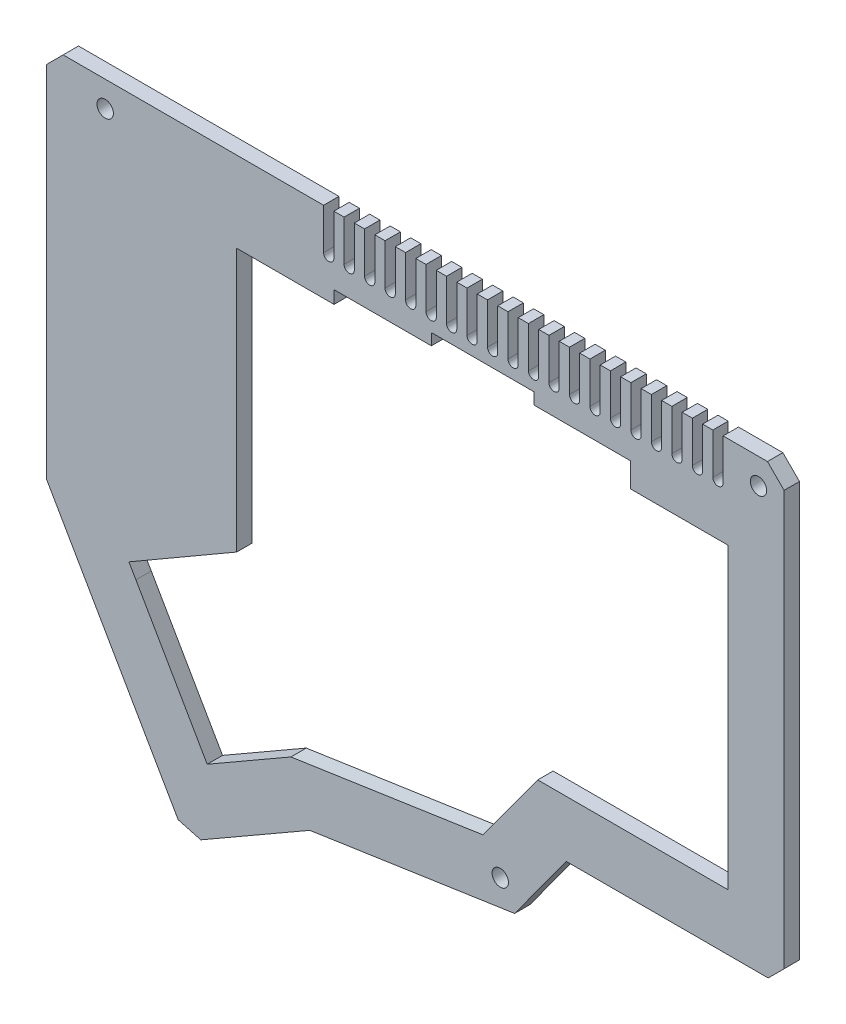
from build123d import *

# Parameters (mm, degrees)
ESQUISSE1_R             = 1.6
BOSS_EXTRU_1_DEPTH      = 3
ENL_V_MAT_EXTRU_1_DEPTH = 10


with BuildPart() as part:
    # Esquisse1 → Boss.-Extru.1 (new body)
    with BuildSketch(Plane.XY):
        Polygon((-13.474992457, 0.072428093), (-16.723236211, 3.320852512), (-154.236345188, 3.320852512), (-157.478985875, 0.078211825), (-157.478985875, -70.04068474), (-131.779420125, -114.771472067), (-127.355917516, -115.9649154), (-106.081983802, -103.720194839), (-66.092540926, -97.775797545), (-55.98795635, -83.933633781), (-16.581747648, -83.933633781), (-13.474992457, -80.826878591), align=None)
        Polygon((-126.111124489, -102.556497988), (-140.02282508, -78.342807898), (-141.407217303, -75.981121034), (-120.346626934, -63.796065222), (-120.346308835, -12.429484403), (-101.345774335, -12.429484403), (-101.345774335, -9.929307079), (-82.344426674, -9.929307079), (-82.344426674, -7.679926158), (-62.343149943, -7.681038584), (-62.343149943, -9.929307079), (-43.477687779, -9.929307079), (-43.477687779, -14.679643994), (-24.474992457, -14.679643994), (-24.474992457, -72.933633781), (-61.577157206, -72.933633781), (-72.263087593, -87.572177036), (-109.761976756, -93.1463556), align=None, mode=Mode.SUBTRACT)
        with Locations((-68.897334865, -93.137788223)):
            Circle(ESQUISSE1_R, mode=Mode.SUBTRACT)
        with Locations((-146.02282508, -1.677868186)):
            Circle(ESQUISSE1_R, mode=Mode.SUBTRACT)
        with Locations((-18.474992457, -1.68453516)):
            Circle(ESQUISSE1_R, mode=Mode.SUBTRACT)
    extrude(amount=BOSS_EXTRU_1_DEPTH)

    # Esquisse2 → Enlèv. mat.-Extru.1 (cut)
    with BuildSketch(Plane.XY.offset(3)):
        with BuildLine():
            Line((-25.386559375, 6.054162745), (-25.386559375, -4.679147488))
            ThreePointArc((-25.386559375, -4.679147488), (-26.386559375, -5.679147488), (-27.386559375, -4.679147488))
            Line((-27.386559375, -4.679147488), (-27.386559375, 6.054162745))
            ThreePointArc((-27.386559375, 6.054162745), (-26.386559375, 7.054162745), (-25.386559375, 6.054162745))
        make_face()
        with BuildLine():
            Line((-29.386559375, 6.054162745), (-29.386559375, -4.679147488))
            ThreePointArc((-29.386559375, -4.679147488), (-30.386559375, -5.679147488), (-31.386559375, -4.679147488))
            Line((-31.386559375, -4.679147488), (-31.386559375, 6.054162745))
            ThreePointArc((-31.386559375, 6.054162745), (-30.386559375, 7.054162745), (-29.386559375, 6.054162745))
        make_face()
        with BuildLine():
            Line((-33.386559375, 6.054162745), (-33.386559375, -4.679147488))
            ThreePointArc((-33.386559375, -4.679147488), (-34.386559375, -5.679147488), (-35.386559375, -4.679147488))
            Line((-35.386559375, -4.679147488), (-35.386559375, 6.054162745))
            ThreePointArc((-35.386559375, 6.054162745), (-34.386559375, 7.054162745), (-33.386559375, 6.054162745))
        make_face()
        with BuildLine():
            Line((-37.386559375, 6.054162745), (-37.386559375, -4.679147488))
            ThreePointArc((-37.386559375, -4.679147488), (-38.386559375, -5.679147488), (-39.386559375, -4.679147488))
            Line((-39.386559375, -4.679147488), (-39.386559375, 6.054162745))
            ThreePointArc((-39.386559375, 6.054162745), (-38.386559375, 7.054162745), (-37.386559375, 6.054162745))
        make_face()
        with BuildLine():
            Line((-41.386559375, 6.054162745), (-41.386559375, -4.679147488))
            ThreePointArc((-41.386559375, -4.679147488), (-42.386559375, -5.679147488), (-43.386559375, -4.679147488))
            Line((-43.386559375, -4.679147488), (-43.386559375, 6.054162745))
            ThreePointArc((-43.386559375, 6.054162745), (-42.386559375, 7.054162745), (-41.386559375, 6.054162745))
        make_face()
        with BuildLine():
            Line((-45.386559375, 6.054162745), (-45.386559375, -4.679147488))
            ThreePointArc((-45.386559375, -4.679147488), (-46.386559375, -5.679147488), (-47.386559375, -4.679147488))
            Line((-47.386559375, -4.679147488), (-47.386559375, 6.054162745))
            ThreePointArc((-47.386559375, 6.054162745), (-46.386559375, 7.054162745), (-45.386559375, 6.054162745))
        make_face()
        with BuildLine():
            Line((-49.386559375, 6.054162745), (-49.386559375, -4.679147488))
            ThreePointArc((-49.386559375, -4.679147488), (-50.386559375, -5.679147488), (-51.386559375, -4.679147488))
            Line((-51.386559375, -4.679147488), (-51.386559375, 6.054162745))
            ThreePointArc((-51.386559375, 6.054162745), (-50.386559375, 7.054162745), (-49.386559375, 6.054162745))
        make_face()
        with BuildLine():
            Line((-53.386559375, 6.054162745), (-53.386559375, -4.679147488))
            ThreePointArc((-53.386559375, -4.679147488), (-54.386559375, -5.679147488), (-55.386559375, -4.679147488))
            Line((-55.386559375, -4.679147488), (-55.386559375, 6.054162745))
            ThreePointArc((-55.386559375, 6.054162745), (-54.386559375, 7.054162745), (-53.386559375, 6.054162745))
        make_face()
        with BuildLine():
            Line((-57.386559375, 6.054162745), (-57.386559375, -4.679147488))
            ThreePointArc((-57.386559375, -4.679147488), (-58.386559375, -5.679147488), (-59.386559375, -4.679147488))
            Line((-59.386559375, -4.679147488), (-59.386559375, 6.054162745))
            ThreePointArc((-59.386559375, 6.054162745), (-58.386559375, 7.054162745), (-57.386559375, 6.054162745))
        make_face()
        with BuildLine():
            Line((-61.386559375, 6.054162745), (-61.386559375, -4.679147488))
            ThreePointArc((-61.386559375, -4.679147488), (-62.386559375, -5.679147488), (-63.386559375, -4.679147488))
            Line((-63.386559375, -4.679147488), (-63.386559375, 6.054162745))
            ThreePointArc((-63.386559375, 6.054162745), (-62.386559375, 7.054162745), (-61.386559375, 6.054162745))
        make_face()
        with BuildLine():
            Line((-65.386559375, 6.054162745), (-65.386559375, -4.679147488))
            ThreePointArc((-65.386559375, -4.679147488), (-66.386559375, -5.679147488), (-67.386559375, -4.679147488))
            Line((-67.386559375, -4.679147488), (-67.386559375, 6.054162745))
            ThreePointArc((-67.386559375, 6.054162745), (-66.386559375, 7.054162745), (-65.386559375, 6.054162745))
        make_face()
        with BuildLine():
            Line((-69.386559375, 6.054162745), (-69.386559375, -4.679147488))
            ThreePointArc((-69.386559375, -4.679147488), (-70.386559375, -5.679147488), (-71.386559375, -4.679147488))
            Line((-71.386559375, -4.679147488), (-71.386559375, 6.054162745))
            ThreePointArc((-71.386559375, 6.054162745), (-70.386559375, 7.054162745), (-69.386559375, 6.054162745))
        make_face()
        with BuildLine():
            Line((-73.386559375, 6.054162745), (-73.386559375, -4.679147488))
            ThreePointArc((-73.386559375, -4.679147488), (-74.386559375, -5.679147488), (-75.386559375, -4.679147488))
            Line((-75.386559375, -4.679147488), (-75.386559375, 6.054162745))
            ThreePointArc((-75.386559375, 6.054162745), (-74.386559375, 7.054162745), (-73.386559375, 6.054162745))
        make_face()
        with BuildLine():
            Line((-77.386559375, 6.054162745), (-77.386559375, -4.679147488))
            ThreePointArc((-77.386559375, -4.679147488), (-78.386559375, -5.679147488), (-79.386559375, -4.679147488))
            Line((-79.386559375, -4.679147488), (-79.386559375, 6.054162745))
            ThreePointArc((-79.386559375, 6.054162745), (-78.386559375, 7.054162745), (-77.386559375, 6.054162745))
        make_face()
        with BuildLine():
            Line((-81.386559375, 6.054162745), (-81.386559375, -4.679147488))
            ThreePointArc((-81.386559375, -4.679147488), (-82.386559375, -5.679147488), (-83.386559375, -4.679147488))
            Line((-83.386559375, -4.679147488), (-83.386559375, 6.054162745))
            ThreePointArc((-83.386559375, 6.054162745), (-82.386559375, 7.054162745), (-81.386559375, 6.054162745))
        make_face()
        with BuildLine():
            Line((-85.386559375, 6.054162745), (-85.386559375, -4.679147488))
            ThreePointArc((-85.386559375, -4.679147488), (-86.386559375, -5.679147488), (-87.386559375, -4.679147488))
            Line((-87.386559375, -4.679147488), (-87.386559375, 6.054162745))
            ThreePointArc((-87.386559375, 6.054162745), (-86.386559375, 7.054162745), (-85.386559375, 6.054162745))
        make_face()
        with BuildLine():
            Line((-89.386559375, 6.054162745), (-89.386559375, -4.679147488))
            ThreePointArc((-89.386559375, -4.679147488), (-90.386559375, -5.679147488), (-91.386559375, -4.679147488))
            Line((-91.386559375, -4.679147488), (-91.386559375, 6.054162745))
            ThreePointArc((-91.386559375, 6.054162745), (-90.386559375, 7.054162745), (-89.386559375, 6.054162745))
        make_face()
        with BuildLine():
            Line((-93.386559375, 6.054162745), (-93.386559375, -4.679147488))
            ThreePointArc((-93.386559375, -4.679147488), (-94.386559375, -5.679147488), (-95.386559375, -4.679147488))
            Line((-95.386559375, -4.679147488), (-95.386559375, 6.054162745))
            ThreePointArc((-95.386559375, 6.054162745), (-94.386559375, 7.054162745), (-93.386559375, 6.054162745))
        make_face()
        with BuildLine():
            Line((-97.386559375, 6.054162745), (-97.386559375, -4.679147488))
            ThreePointArc((-97.386559375, -4.679147488), (-98.386559375, -5.679147488), (-99.386559375, -4.679147488))
            Line((-99.386559375, -4.679147488), (-99.386559375, 6.054162745))
            ThreePointArc((-99.386559375, 6.054162745), (-98.386559375, 7.054162745), (-97.386559375, 6.054162745))
        make_face()
        with BuildLine():
            Line((-101.386559375, 6.054162745), (-101.386559375, -4.679147488))
            ThreePointArc((-101.386559375, -4.679147488), (-102.386559375, -5.679147488), (-103.386559375, -4.679147488))
            Line((-103.386559375, -4.679147488), (-103.386559375, 6.054162745))
            ThreePointArc((-103.386559375, 6.054162745), (-102.386559375, 7.054162745), (-101.386559375, 6.054162745))
        make_face()
    extrude(amount=-ENL_V_MAT_EXTRU_1_DEPTH, mode=Mode.SUBTRACT)


solid = part.part
